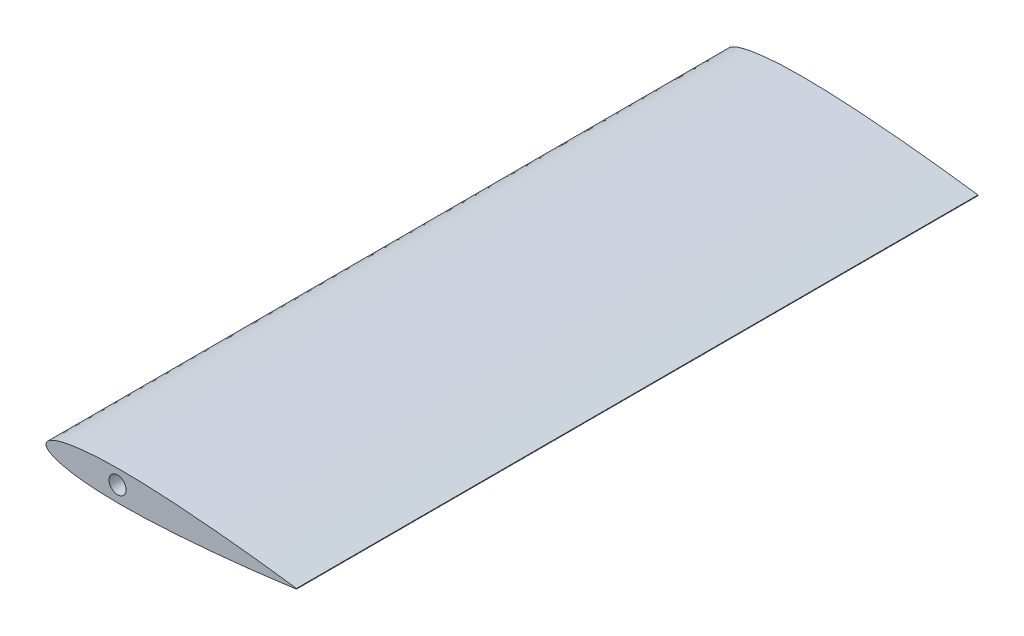
from build123d import *

# Parameters (mm, degrees)
BOSS_EXTRUDE4_DEPTH = 80
SKETCH8_R           = 1
CUT_EXTRUDE3_DEPTH  = 85.911227224


with BuildPart() as part:
    # Sketch7 → Boss-Extrude4 (new body)
    with BuildSketch(Plane.XY):
        with BuildLine():
            Line((1, -0.10458), (1, -0.030492))
            add(Edge.make_bspline(
                [(1, -0.030492), (0.4391072, 0.048291643), (-1.674403185, 0.334004631), (-4.617530754, 0.684240443), (-8.132656486, 1.046660581), (-10.797969598, 1.284679919), (-13.346212552, 1.471490986), (-15.458523396, 1.594302147), (-17.534124999, 1.675667087), (-19.529591939, 1.706588124), (-21.218108073, 1.682770802), (-22.598496265, 1.62014828), (-23.68140911, 1.53967512), (-24.671353768, 1.432175628), (-25.432681359, 1.318284621), (-25.987666395, 1.213155291), (-26.36247535, 1.13107875), (-26.707765564, 1.043628683), (-27.022774053, 0.951196852), (-27.306806225, 0.854090221), (-27.559256366, 0.752644178), (-27.779624738, 0.647151373), (-27.967491511, 0.537831437), (-28.122637923, 0.424869691), (-28.244764188, 0.308080317), (-28.333575795, 0.187132471), (-28.387875352, 0.061434974), (-28.405910061, -0.067536), (-28.387875352, -0.196506974), (-28.333575795, -0.322204471), (-28.244764188, -0.443152317), (-28.122637923, -0.559941691), (-27.967491511, -0.672903437), (-27.779624738, -0.782223373), (-27.559256366, -0.887716178), (-27.306806225, -0.989162221), (-27.022774053, -1.086268852), (-26.707765564, -1.178700683), (-26.36247535, -1.26615075), (-25.845317635, -1.379399155), (-25.128587685, -1.503940817), (-24.18858799, -1.624259365), (-22.953504403, -1.736332976), (-21.40315583, -1.815152516), (-19.299544677, -1.84491037), (-17.068129243, -1.798767021), (-14.756327199, -1.692559872), (-12.641605147, -1.558113836), (-10.329512475, -1.378613782), (-8.303516398, -1.19440739), (-5.692375718, -0.932615266), (-3.109793095, -0.64378772), (-0.644324126, -0.330601026), (0.586969476, -0.162396474), (0.948583439, -0.111802029), (1, -0.10458)],
                knots=[0, 0, 0, 0, 0.028342901, 0.106722049, 0.148306055, 0.205171367, 0.2406214, 0.276160573, 0.311047092, 0.344559266, 0.37601757, 0.395537659, 0.413698812, 0.430349273, 0.445356904, 0.452209372, 0.458611567, 0.464554044, 0.47002985, 0.475034902, 0.479569141, 0.483636857, 0.487250263, 0.490431338, 0.493218828, 0.495674086, 0.497891368, 0.5, 0.502108632, 0.504325914, 0.506781172, 0.509568662, 0.512749737, 0.516363143, 0.520430859, 0.524965098, 0.52997015, 0.535445956, 0.541388433, 0.547790628, 0.561933981, 0.577778559, 0.595202024, 0.62398243, 0.655440734, 0.700464146, 0.735649713, 0.771241831, 0.806495957, 0.851693945, 0.873039495, 0.937813387, 0.981728388, 0.997401831, 1, 1, 1, 1], degree=3))
        make_face()
    extrude(amount=BOSS_EXTRUDE4_DEPTH)

    # Sketch8 → Cut-Extrude3 (cut, through all)
    with BuildSketch(Plane.XY.offset(80)):
        with Locations((-20, 0)):
            Circle(SKETCH8_R)
    extrude(amount=-CUT_EXTRUDE3_DEPTH, mode=Mode.SUBTRACT)


solid = part.part
